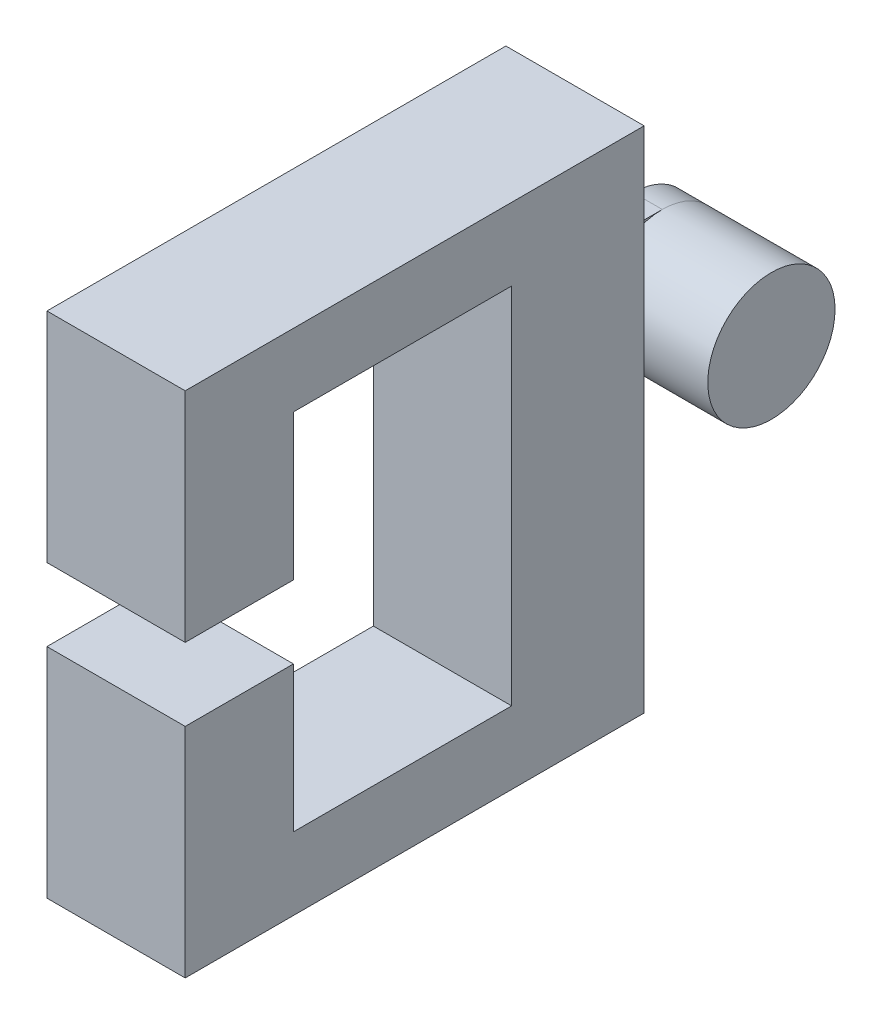
from build123d import *

# Parameters (mm, degrees)
BASE_SKETCH_R      = 11.112881
FEATURE_A_DEPTH    = 9.525
FEATURE_B_SKETCH_W = 22.225762
FEATURE_B_SKETCH_H = 33.338516
FEATURE_B_DEPTH    = 5.09143
FILLET1_R          = 11.112754
FILLET2_R          = 11.112754
FEATURE_C_SKETCH_W = 88.7984
FEATURE_C_SKETCH_H = 23.139146
FEATURE_C_DEPTH    = 24.14143
FEATURE_D_SKETCH_W = 12.6492
FEATURE_D_SKETCH_H = 38.1
FEATURE_D_DEPTH    = 24.14143
FEATURE_E_SKETCH_W = 38.0492
FEATURE_E_SKETCH_H = 18.899378
FEATURE_E_DEPTH    = 24.14143


with BuildPart() as part:
    # Base Sketch → Feature A (new, symmetric)
    with BuildSketch(Plane.YZ):
        with Locations(Location((0, -22.225635, 0), (0, 0, 90))):
            Circle(BASE_SKETCH_R)
    extrude(amount=FEATURE_A_DEPTH, both=True)

    # Feature B Sketch → Feature B (add)
    with BuildSketch(Plane(origin=(-9.525, 0, 0), x_dir=(0, -1, 0), z_dir=(-1, 0, 0))):
        with Locations((0, -16.669258)):
            Rectangle(FEATURE_B_SKETCH_W, FEATURE_B_SKETCH_H)
    extrude(amount=FEATURE_B_DEPTH)

    # Fillet1
    fillet1_edges = [part.edges().sort_by_distance(p)[0] for p in [
        (-12.070715, 11.112881, -33.338516),
    ]]
    fillet(fillet1_edges, radius=FILLET1_R)

    # Fillet2
    fillet2_edges = [part.edges().sort_by_distance(p)[0] for p in [
        (-12.070715, -11.112881, -33.338516),
    ]]
    fillet(fillet2_edges, radius=FILLET2_R)

    # Feature C Sketch → Feature C (add)
    with BuildSketch(Plane.YZ.offset(9.525)):
        with Locations((0, 11.569573)):
            Rectangle(FEATURE_C_SKETCH_W, FEATURE_C_SKETCH_H)
    extrude(amount=-FEATURE_C_DEPTH)

    # Feature D Sketch → Feature D (add)
    with BuildSketch(Plane.YZ.offset(9.525)):
        with Locations((38.0746, 42.189146)):
            Rectangle(FEATURE_D_SKETCH_W, FEATURE_D_SKETCH_H)
        with Locations((-38.0746, 42.189146)):
            Rectangle(FEATURE_D_SKETCH_W, FEATURE_D_SKETCH_H)
    extrude(amount=-FEATURE_D_DEPTH)

    # Feature E Sketch → Feature E (add)
    with BuildSketch(Plane.YZ.offset(9.525)):
        with Locations((25.3746, 70.688835)):
            Rectangle(FEATURE_E_SKETCH_W, FEATURE_E_SKETCH_H)
        with Locations((-25.3746, 70.688835)):
            Rectangle(FEATURE_E_SKETCH_W, FEATURE_E_SKETCH_H)
    extrude(amount=-FEATURE_E_DEPTH)


solid = part.part
